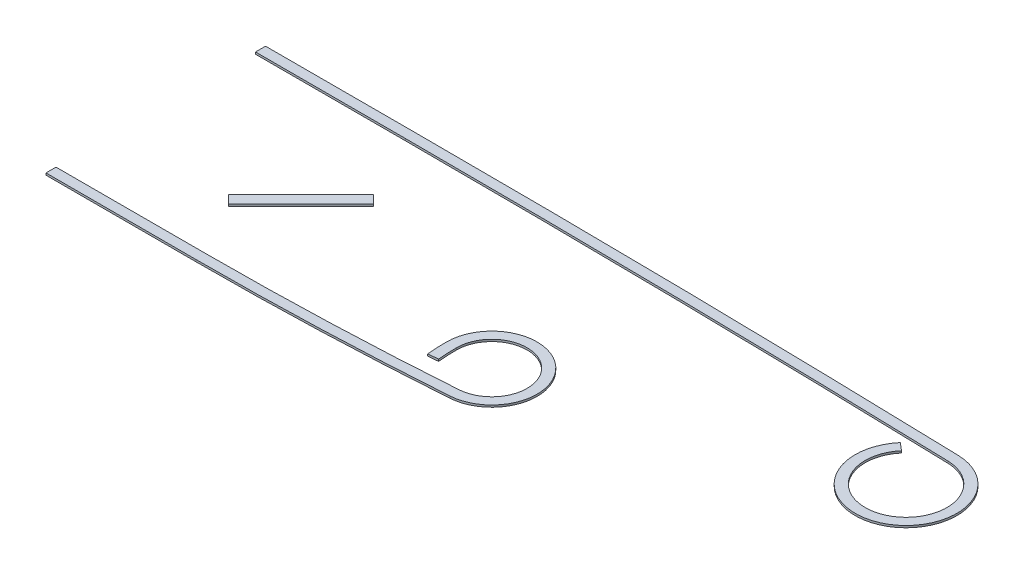
from build123d import *

# Parameters (mm, degrees)
BOSS_EXTRUDE1_DEPTH   = 0.5
BOSS_EXTRUDE1_2_DEPTH = 0.5
BOSS_EXTRUDE1_3_DEPTH = 0.5


with BuildPart() as part:
    # Sketch1 → Boss-Extrude1 (new, symmetric)
    with BuildSketch(Plane(origin=(0, 0, 0), x_dir=(1, 0, 0), z_dir=(0, 1, 0))):
        with BuildLine():
            Line((0, 57.3), (-75, 57.3))
            Line((-75, 57.3), (-75, 52.3))
            Line((-75, 52.3), (0, 52.3))
            ThreePointArc((0, 52.3), (137.407875272, 51.297776384), (274.786512082, 48.291318796))
            ThreePointArc((274.786512082, 48.291318796), (288.825291969, 42.113029408), (294.591434137, 27.9))
            ThreePointArc((294.591434137, 27.9), (267.143524545, 8.756150586), (258.661339001, 41.127854893))
            Line((258.661339001, 41.127854893), (254.854943134, 44.36997619))
            ThreePointArc((254.854943134, 44.36997619), (265.416095723, 4.064030632), (299.591434137, 27.9))
            ThreePointArc((299.591434137, 27.9), (292.412021829, 45.596615048), (274.932364519, 53.28919105))
            ThreePointArc((274.932364519, 53.28919105), (137.48080925, 56.297244419), (0, 57.3))
        make_face()
    extrude(amount=BOSS_EXTRUDE1_DEPTH, both=True)


with BuildPart() as body_2:
    # Sketch1 → Boss-Extrude1 2 (new, symmetric)
    with BuildSketch(Plane(origin=(0, 0, 0), x_dir=(1, 0, 0), z_dir=(0, 1, 0))):
        with BuildLine():
            Line((0, -47.3), (-75, -47.3))
            Line((-75, -47.3), (-75, -52.3))
            Line((-75, -52.3), (0, -52.3))
            ThreePointArc((0, -52.3), (61.176510654, -51.203966518), (122.274500718, -47.91727284))
            ThreePointArc((122.274500718, -47.91727284), (136.055904415, -8.828175809), (98.053793185, -25.372786309))
            ThreePointArc((98.053793185, -25.372786309), (98.17690041, -30.328625843), (98.545918412, -35.272240572))
            Line((98.545918412, -35.272240572), (103.521266149, -34.776342501))
            ThreePointArc((103.521266149, -34.776342501), (103.170733541, -30.080370616), (103.053793184, -25.372786309))
            ThreePointArc((103.053793184, -25.372786309), (132.64928349, -12.488084807), (121.916527169, -42.93010381))
            ThreePointArc((121.916527169, -42.93010381), (60.99740894, -46.20717529), (0, -47.3))
        make_face()
    extrude(amount=BOSS_EXTRUDE1_2_DEPTH, both=True)


with BuildPart() as body_3:
    # Sketch1 → Boss-Extrude1 3 (new, symmetric)
    with BuildSketch(Plane(origin=(0, 0, 0), x_dir=(1, 0, 0), z_dir=(0, 1, 0))):
        Polygon((-16.01243306, -20.191434137), (20.191434137, 16.01243306), (16.01243306, 20.191434137), (-20.191434137, -16.01243306), align=None)
    extrude(amount=BOSS_EXTRUDE1_3_DEPTH, both=True)


solid = Compound([part.part, body_2.part, body_3.part])
